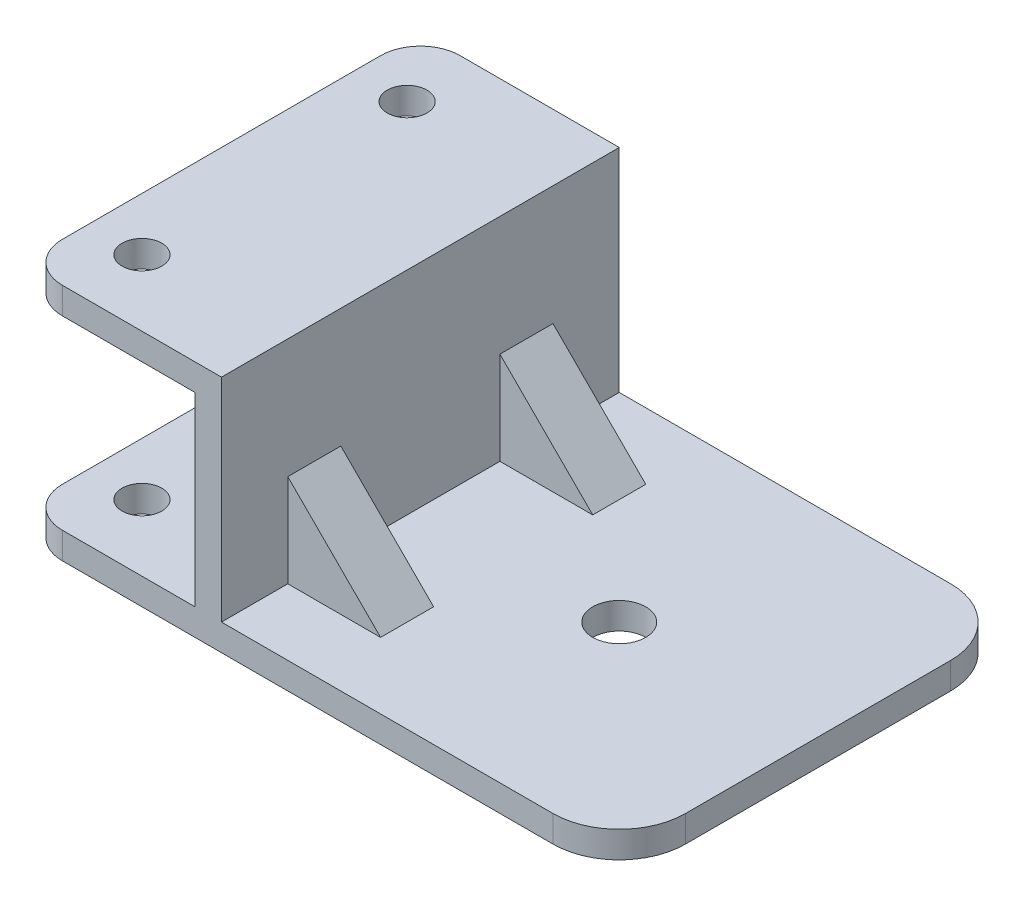
from build123d import *

# Parameters (mm, degrees)
BOSS_EXTRUDE1_DEPTH = 15
SKETCH2_R           = 1.5
CUT_EXTRUDE1_DEPTH  = 28.820855486
FILLET1_R           = 3
SKETCH3_W           = 30
SKETCH3_H           = 30
BOSS_EXTRUDE2_DEPTH = 2
BOSS_EXTRUDE3_DEPTH = 10
CUT_EXTRUDE2_DEPTH  = 6
SKETCH7_R           = 2
CUT_EXTRUDE3_DEPTH  = 12
FILLET2_R           = 5


with BuildPart() as part:
    # Sketch1 → Boss-Extrude1 (new, symmetric)
    with BuildSketch(Plane.XY):
        Polygon((0, 0), (15, 0), (15, 18), (0, 18), (0, 16), (13, 16), (13, 2), (0, 2), align=None)
    extrude(amount=BOSS_EXTRUDE1_DEPTH, both=True)

    # Sketch2 → Cut-Extrude1 (cut, through all)
    with BuildSketch(Plane(origin=(0, 18, 0), x_dir=(1, 0, 0), z_dir=(0, 1, 0))):
        with Locations(Location((4, 10, 0), (0, 0, 270))):
            Circle(SKETCH2_R)
        with Locations(Location((4, -10, 0), (0, 0, 270))):
            Circle(SKETCH2_R)
    extrude(amount=-CUT_EXTRUDE1_DEPTH, mode=Mode.SUBTRACT)

    # Fillet1
    fillet1_edges = [part.edges().sort_by_distance(p)[0] for p in [
        (0, 1, -15),
        (0, 17, 15),
        (0, 1, 15),
        (0, 17, -15),
    ]]
    fillet(fillet1_edges, radius=FILLET1_R)

    # Sketch3 → Boss-Extrude2 (add)
    with BuildSketch(Plane.XZ):
        with Locations((30, 0)):
            Rectangle(SKETCH3_W, SKETCH3_H)
    extrude(amount=-BOSS_EXTRUDE2_DEPTH)

    # Sketch5 → Boss-Extrude3 (add, symmetric)
    with BuildSketch(Plane.XY):
        Polygon((15, 2), (15, 9), (22, 2), align=None)
    extrude(amount=BOSS_EXTRUDE3_DEPTH, both=True)

    # Sketch6 → Cut-Extrude2 (cut, symmetric)
    with BuildSketch(Plane.XY):
        Polygon((15, 2), (15, 9), (22, 2), align=None)
    extrude(amount=CUT_EXTRUDE2_DEPTH, both=True, mode=Mode.SUBTRACT)

    # Sketch7 → Cut-Extrude3 (cut)
    with BuildSketch(Plane(origin=(0, 2, 0), x_dir=(1, 0, 0), z_dir=(0, 1, 0))):
        with Locations(Location((30, 0, 0), (0, 0, 270))):
            Circle(SKETCH7_R)
    extrude(amount=-CUT_EXTRUDE3_DEPTH, mode=Mode.SUBTRACT)

    # Fillet2
    fillet2_edges = [part.edges().sort_by_distance(p)[0] for p in [
        (45, 1, 15),
        (45, 1, -15),
    ]]
    fillet(fillet2_edges, radius=FILLET2_R)


solid = part.part
